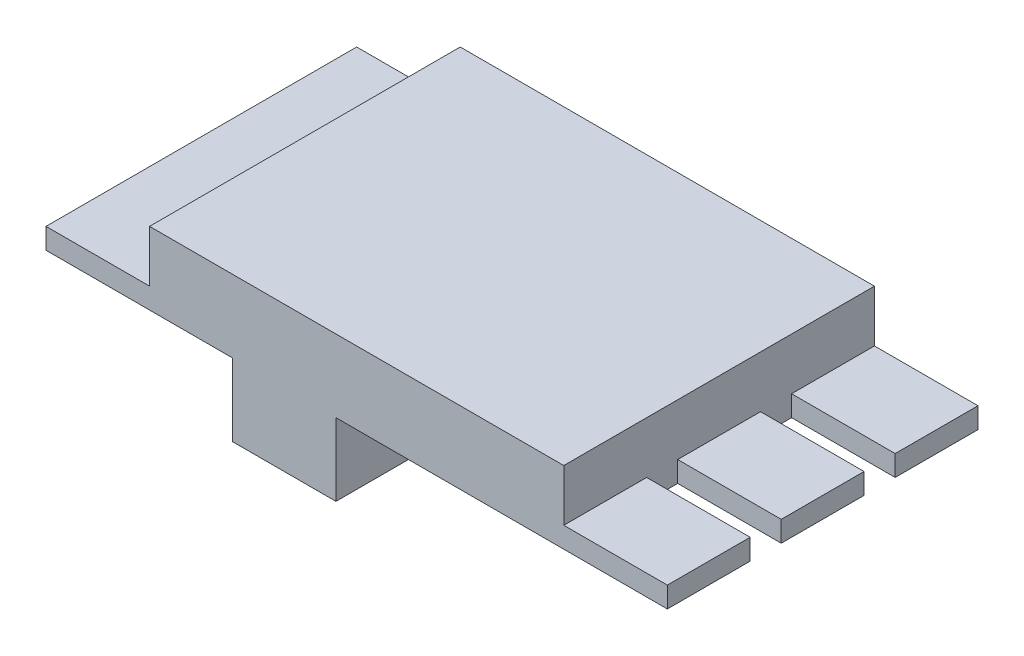
from build123d import *

# Parameters (mm, degrees)
SKETCH1_W           = 30
SKETCH1_H           = 15
BOSS_EXTRUDE1_DEPTH = 7
SKETCH3_W           = 5
SKETCH3_H           = 2.5
SKETCH3_W_2         = 9
SKETCH3_H_2         = 3.5
SKETCH3_W_3         = 16
CUT_EXTRUDE1_DEPTH  = 18.5
SKETCH4_W           = 5
SKETCH4_H           = 1.5
CUT_EXTRUDE2_DEPTH  = 18.5


with BuildPart() as part:
    # Sketch1 → Boss-Extrude1 (new body)
    with BuildSketch(Plane(origin=(0, 0, 0), x_dir=(1, 0, 0), z_dir=(0, 1, 0))):
        Rectangle(SKETCH1_W, SKETCH1_H)
    extrude(amount=BOSS_EXTRUDE1_DEPTH)

    # Sketch3 → Cut-Extrude1 (cut, symmetric)
    with BuildSketch(Plane.XY.offset(7.5)):
        with Locations((-12.5, 5.75)):
            Rectangle(SKETCH3_W, SKETCH3_H)
        with Locations((-10.5, 1.75)):
            Rectangle(SKETCH3_W_2, SKETCH3_H_2)
        with Locations((12.5, 5.75)):
            Rectangle(SKETCH3_W, SKETCH3_H)
        with Locations((7, 1.75)):
            Rectangle(SKETCH3_W_3, SKETCH3_H_2)
    extrude(amount=CUT_EXTRUDE1_DEPTH, both=True, mode=Mode.SUBTRACT)

    # Sketch4 → Cut-Extrude2 (cut, symmetric)
    with BuildSketch(Plane(origin=(0, 7, 0), x_dir=(1, 0, 0), z_dir=(0, 1, 0))):
        with Locations((12.5, 2.75)):
            Rectangle(SKETCH4_W, SKETCH4_H)
        with Locations((12.5, -2.75)):
            Rectangle(SKETCH4_W, SKETCH4_H)
    extrude(amount=CUT_EXTRUDE2_DEPTH, both=True, mode=Mode.SUBTRACT)


solid = part.part
